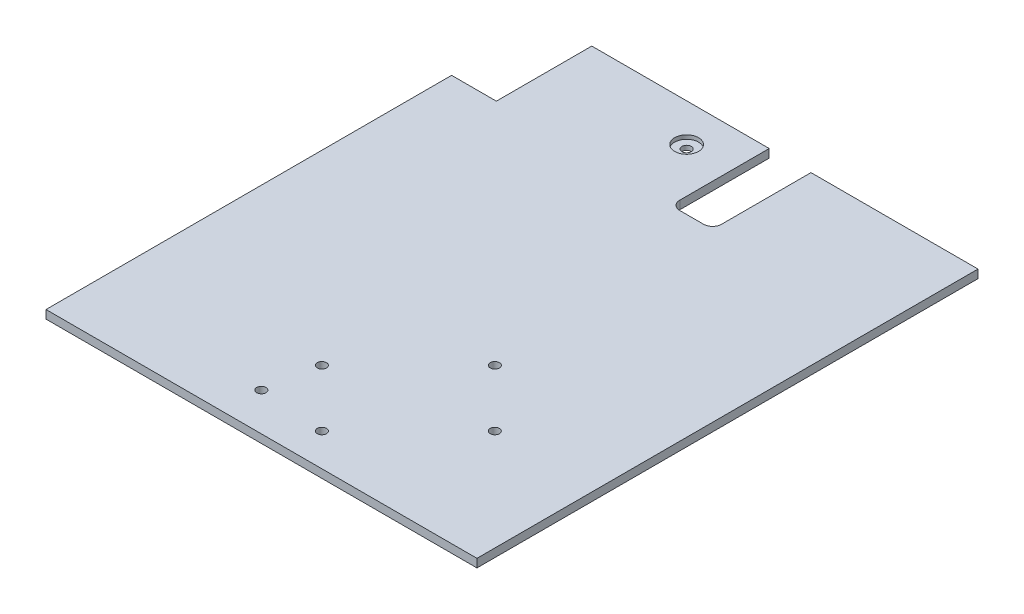
from build123d import *

# Parameters (mm, degrees)
SKETCH1_R           = 1.55
BOSS_EXTRUDE1_DEPTH = 2.8
CUT_EXTRUDE1_REACH  = 112.833
SKETCH2_R           = 1.55
SKETCH3_R           = 4
CUT_EXTRUDE2_DEPTH  = 1.3
CUT_EXTRUDE3_REACH  = 112.833


with BuildPart() as part:
    # Sketch1 → Boss-Extrude1 (new body)
    with BuildSketch(Plane(origin=(0, 0, 0), x_dir=(1, 0, 0), z_dir=(0, 1, 0))):
        Polygon((-72.25, 52), (-72.25, -84), (72.25, -84), (72.25, 84), (-57.25, 84), (-57.25, 52), align=None)
        with Locations(Location((-9.79163056, -53.949747468, 0), (0, 0, 270))):
            Circle(SKETCH1_R, mode=Mode.SUBTRACT)
        with Locations(Location((9.300252532, -73.04163056, 0), (0, 0, 270))):
            Circle(SKETCH1_R, mode=Mode.SUBTRACT)
        with Locations(Location((38.29163056, -44.050252532, 0), (0, 0, 270))):
            Circle(SKETCH1_R, mode=Mode.SUBTRACT)
        with Locations(Location((19.199747468, -24.95836944, 0), (0, 0, 270))):
            Circle(SKETCH1_R, mode=Mode.SUBTRACT)
    extrude(amount=BOSS_EXTRUDE1_DEPTH)

    # Sketch2 → Cut-Extrude1 (cut, up to next)
    with BuildSketch(Plane(origin=(0, 2.8, 0), x_dir=(1, 0, 0), z_dir=(0, 1, 0)), mode=Mode.PRIVATE) as cut_extrude1_sk1:
        with Locations(Location((-12.75, 71.3, 0), (0, 0, 270))):
            Circle(SKETCH2_R)
    cut_extrude1_tool1 = extrude(cut_extrude1_sk1.sketch, amount=-CUT_EXTRUDE1_REACH, mode=Mode.PRIVATE) & part.part
    # Sketch2 → Cut-Extrude1 (cut, up to next)
    with BuildSketch(Plane(origin=(0, 2.8, 0), x_dir=(1, 0, 0), z_dir=(0, 1, 0)), mode=Mode.PRIVATE) as cut_extrude1_sk2:
        with Locations(Location((-12.75, -71.3, 0), (0, 0, 270))):
            Circle(SKETCH2_R)
    cut_extrude1_tool2 = extrude(cut_extrude1_sk2.sketch, amount=-CUT_EXTRUDE1_REACH, mode=Mode.PRIVATE) & part.part
    add(cut_extrude1_tool1.solids().sort_by_distance((-12.75, 2.8, -71.3))[0], mode=Mode.SUBTRACT)
    add(cut_extrude1_tool2.solids().sort_by_distance((-12.75, 2.8, 71.3))[0], mode=Mode.SUBTRACT)

    # Sketch3 → Cut-Extrude2 (cut)
    with BuildSketch(Plane(origin=(0, 2.8, 0), x_dir=(1, 0, 0), z_dir=(0, 1, 0))):
        with Locations(Location((-12.75, 71.3, 0), (0, 0, 270))):
            Circle(SKETCH3_R)
    extrude(amount=-CUT_EXTRUDE2_DEPTH, mode=Mode.SUBTRACT)

    # Sketch4 → Cut-Extrude3 (cut, up to next)
    with BuildSketch(Plane(origin=(0, 2.8, 0), x_dir=(1, 0, 0), z_dir=(0, 1, 0)), mode=Mode.PRIVATE) as cut_extrude3_sk1:
        with BuildLine():
            Line((16.25, 84), (2.25, 84))
            Line((2.25, 84), (2.25, 54))
            ThreePointArc((2.25, 54), (3.128679656, 51.878679656), (5.25, 51))
            Line((5.25, 51), (13.25, 51))
            ThreePointArc((13.25, 51), (15.371320344, 51.878679656), (16.25, 54))
            Line((16.25, 54), (16.25, 84))
        make_face()
    cut_extrude3_tool1 = extrude(cut_extrude3_sk1.sketch, amount=-CUT_EXTRUDE3_REACH, mode=Mode.PRIVATE) & part.part
    add(cut_extrude3_tool1.solids().sort_by_distance((9.25, 2.8, -67.633471))[0], mode=Mode.SUBTRACT)


solid = part.part
